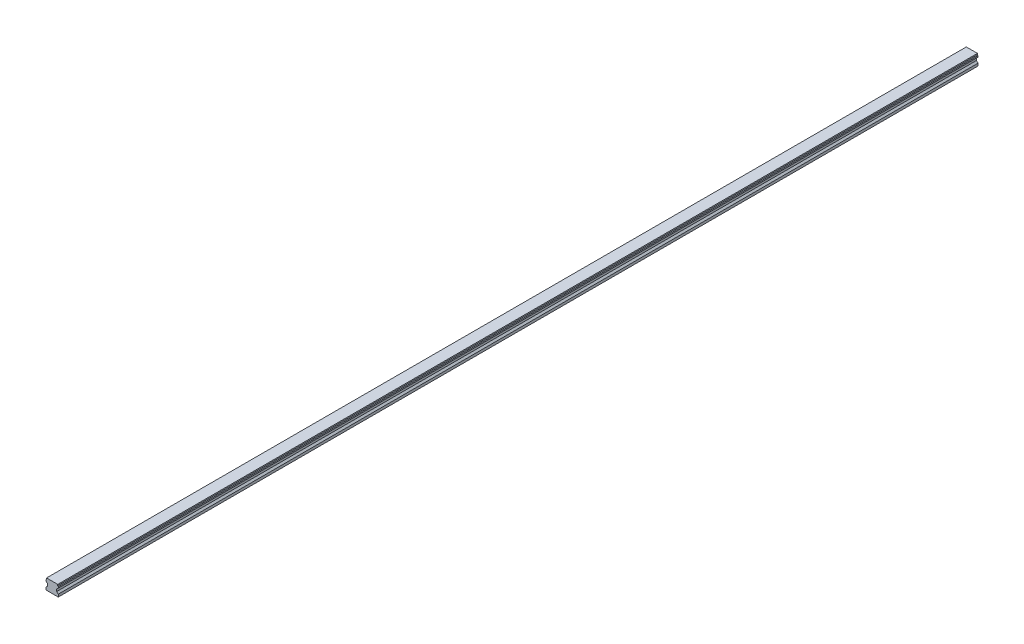
from build123d import *

# Parameters (mm, degrees)
BOSS_EXTRUDE1_DEPTH = 1500


with BuildPart() as part:
    # Sketch1 → Boss-Extrude1 (new body)
    with BuildSketch(Plane.XY):
        Polygon((9.1, 0), (9.1, -2), (10, -2.9), (10, -4.9), (7.5, -7.4), (7.5, -10.9), (10, -13.4), (10, -17.5), (-10, -17.5), (-10, -13.4), (-7.5, -10.9), (-7.5, -7.4), (-10, -4.9), (-10, -2.9), (-9.1, -2), (-9.1, 0), align=None)
    extrude(amount=-BOSS_EXTRUDE1_DEPTH)


solid = part.part
